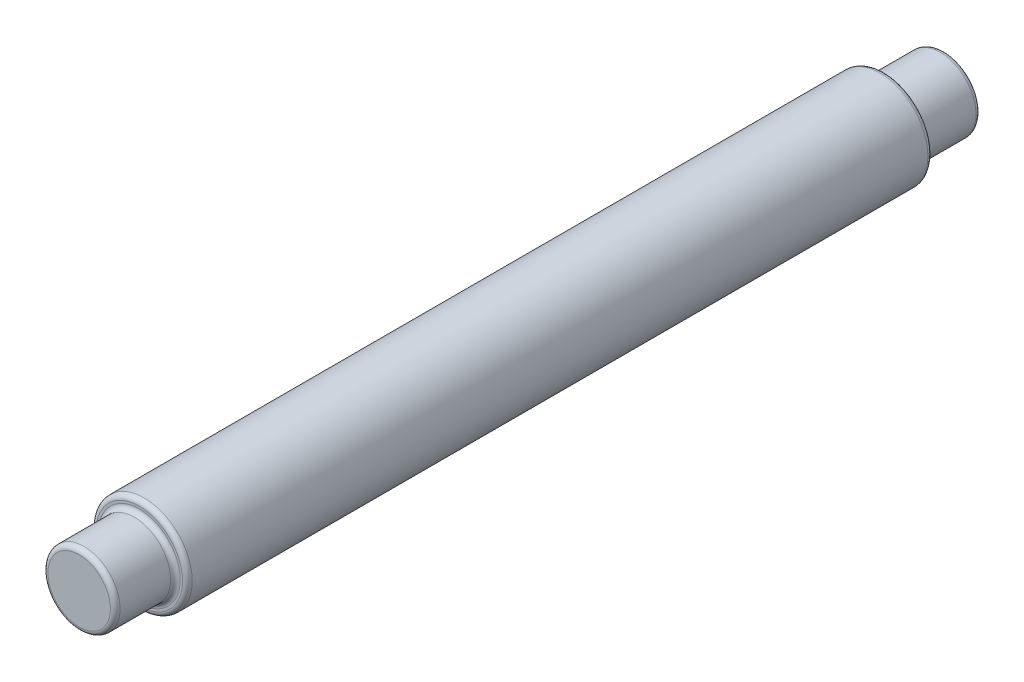
from build123d import *

# Parameters (mm, degrees)
SKETCH1_R           = 1
BOSS_EXTRUDE1_DEPTH = 7.75
SKETCH2_R           = 0.75
BOSS_EXTRUDE2_DEPTH = 9
FILLET1_R           = 0.1


with BuildPart() as part:
    # Sketch1 → Boss-Extrude1 (new, symmetric)
    with BuildSketch(Plane.XY):
        Circle(SKETCH1_R)
    extrude(amount=BOSS_EXTRUDE1_DEPTH, both=True)

    # Sketch2 → Boss-Extrude2 (add, symmetric)
    with BuildSketch(Plane.XY):
        Circle(SKETCH2_R)
    extrude(amount=BOSS_EXTRUDE2_DEPTH, both=True)

    # Fillet1
    fillet1_edges = [part.edges().sort_by_distance(p)[0] for p in [
        (-1, 0, -7.75),
        (-1, 0, 7.75),
        (-0.75, 0, -7.75),
        (-0.75, 0, 7.75),
        (-0.75, 0, -9),
        (-0.75, 0, 9),
    ]]
    fillet(fillet1_edges, radius=FILLET1_R)


solid = part.part
